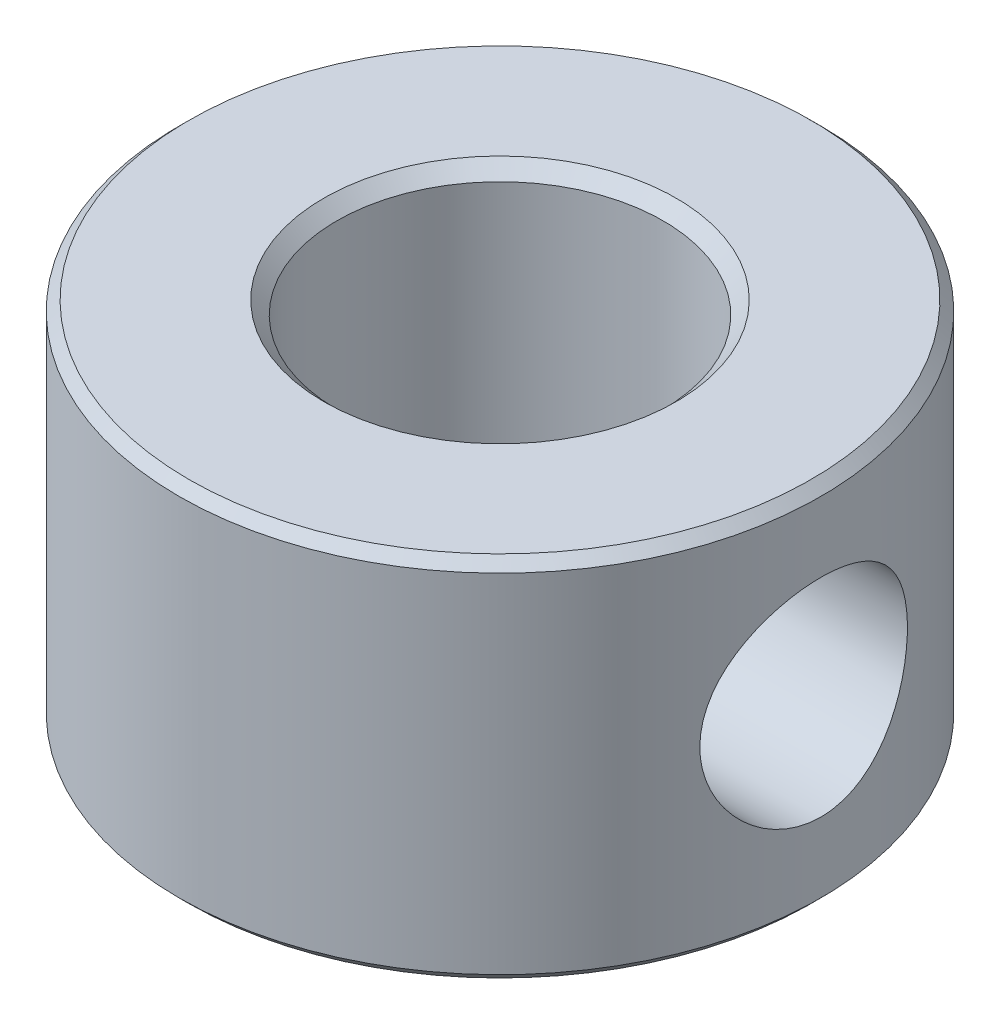
from build123d import *

# Parameters (mm, degrees)
SKETCH1_R           = 6.24205
SKETCH1_R_2         = 3.175
BOSS_EXTRUDE1_DEPTH = 7.14502
CHAMFER1_SIZE       = 0.1905
CHAMFER2_SIZE       = 0.254
SKETCH3_W           = 2.0193
SKETCH3_H           = 6.24205


with BuildPart() as part:
    # Sketch1 → Boss-Extrude1 (new body)
    with BuildSketch(Plane(origin=(0, 0, 0), x_dir=(1, 0, 0), z_dir=(0, 1, 0))):
        with Locations(Location((0, 0, 0), (0, 0, 90))):
            Circle(SKETCH1_R)
        with Locations(Location((0, 0, 0), (0, 0, 90))):
            Circle(SKETCH1_R_2, mode=Mode.SUBTRACT)
    extrude(amount=BOSS_EXTRUDE1_DEPTH)

    # Chamfer1
    chamfer1_edges = [part.edges().sort_by_distance(p)[0] for p in [
        (0, 0, 6.24205),
        (0, 7.14502, 6.24205),
    ]]
    chamfer(chamfer1_edges, length=CHAMFER1_SIZE)

    # Chamfer2
    chamfer2_edges = [part.edges().sort_by_distance(p)[0] for p in [
        (0, 0, 3.175),
        (0, 7.14502, 3.175),
    ]]
    chamfer(chamfer2_edges, length=CHAMFER2_SIZE)

    # Sketch3 → #10-32 Tapped Hole1 (revolve, cut)
    with BuildSketch(Plane.ZX.offset(3.57251)):
        with Locations((1.00965, 3.121025)):
            Rectangle(SKETCH3_W, SKETCH3_H)
    revolve(axis=Axis((-6.35, 3.57251, 0), (1, 0, 0)), mode=Mode.SUBTRACT)


solid = part.part
